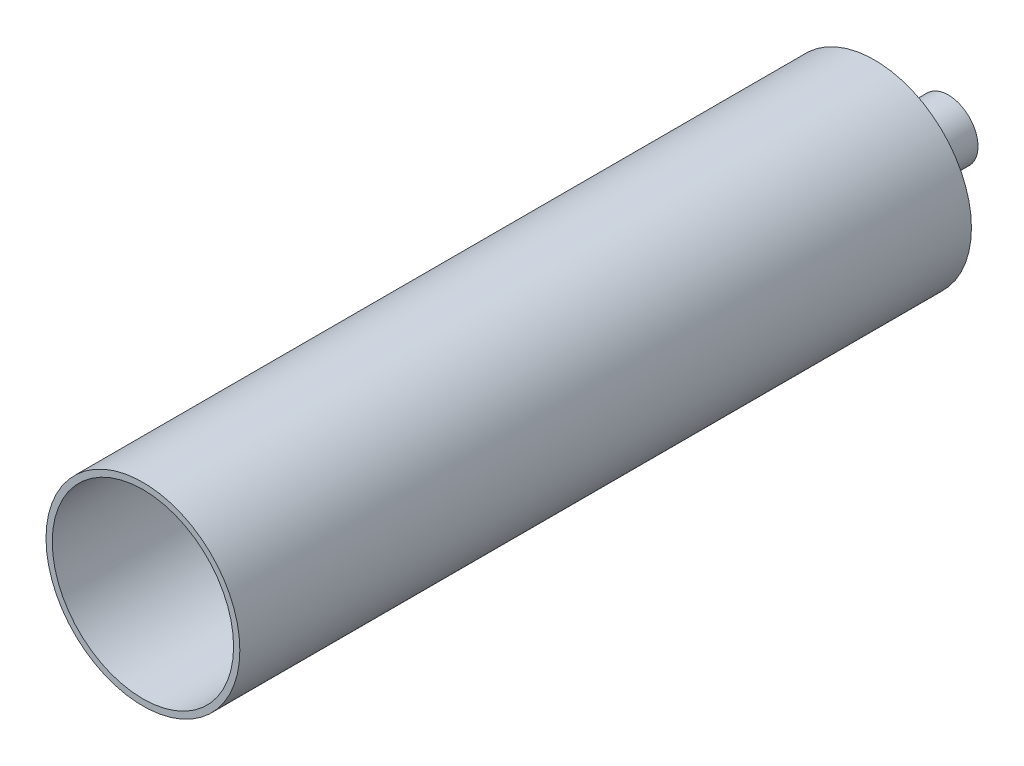
from build123d import *

# Parameters (mm, degrees)
SKETCH1_R           = 15.5
SKETCH1_R_2         = 14.5
BOSS_EXTRUDE1_DEPTH = 117


with BuildPart() as part:
    # Sketch1 → Boss-Extrude1 (new body)
    with BuildSketch(Plane.XY):
        Circle(SKETCH1_R)
        Circle(SKETCH1_R_2, mode=Mode.SUBTRACT)
    extrude(amount=BOSS_EXTRUDE1_DEPTH)

    # Sketch4 → Revolve1 (revolve)
    with BuildSketch(Plane(origin=(0, 0, 0), x_dir=(0, 0, -1), z_dir=(1, 0, 0)), mode=Mode.PRIVATE) as revolve1_sk:
        Polygon((0, -15.5), (4.3, -4.75), (11.8, -4.75), (11.8, 0), (4.3, 0), (3.3, 0), (3.3, -4.75), (0, -13), align=None)
    revolve(revolve1_sk.sketch.rotate(Axis((0, 0, 0), (0, 0, -1)), 270), axis=Axis((0, 0, 0), (0, 0, -1)))


solid = part.part
